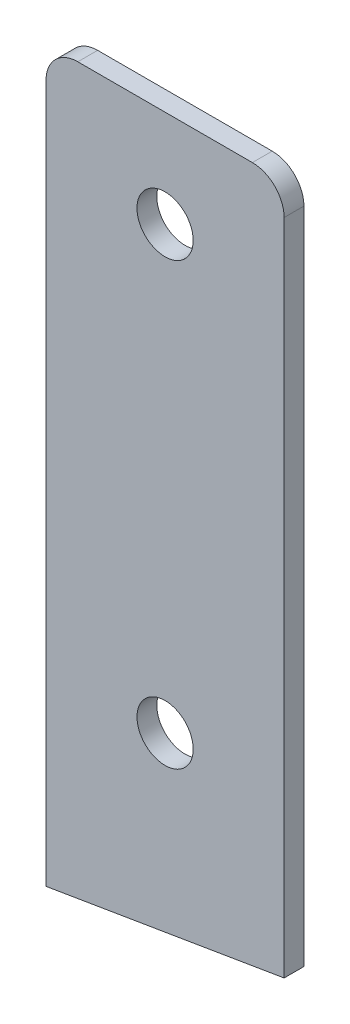
from build123d import *

# Parameters (mm, degrees)
SKETCH1_W               = 19.05
SKETCH1_H               = 50.8
BOSS_EXTRUDE1_DEPTH     = 1.5875
M4_CLEARANCE_HOLE1_D    = 4.5
SKETCH4_W               = 19.05
SKETCH4_H               = 7.62
BOSS_EXTRUDE2_DEPTH     = 1.5875
FILLET1_R               = 2.54
CUT_EXTRUDE1_DEPTH      = 35.40299669
CUT_EXTRUDE1_DEPTH_BACK = 35.40299669


with BuildPart() as part:
    # Sketch1 → Boss-Extrude1 (new body)
    with BuildSketch(Plane.XY):
        Rectangle(SKETCH1_W, SKETCH1_H)
    extrude(amount=BOSS_EXTRUDE1_DEPTH)

    # M4 Clearance Hole1 (through all)
    with Locations(Plane.XY.offset(1.5875)):
        with Locations((0, 17.6276), (0, -17.6276)):
            Hole(M4_CLEARANCE_HOLE1_D / 2)

    # Sketch4 → Boss-Extrude2 (add)
    with BuildSketch(Plane.XY.offset(1.5875)):
        with Locations((0, -29.21)):
            Rectangle(SKETCH4_W, SKETCH4_H)
    extrude(amount=-BOSS_EXTRUDE2_DEPTH)

    # Fillet1
    fillet1_edges = [part.edges().sort_by_distance(p)[0] for p in [
        (-9.525, 25.4, 0.79375),
        (9.525, 25.4, 0.79375),
    ]]
    fillet(fillet1_edges, radius=FILLET1_R)

    # Sketch5 → Cut-Extrude1 (cut, two sides: drawn at the far end of the back side and taken through both)
    with BuildSketch(Plane.XY.offset(1.5875).offset(-CUT_EXTRUDE1_DEPTH_BACK)):
        Polygon((9.525, -29.845), (-9.525, -33.02), (9.525, -33.02), align=None)
    extrude(amount=CUT_EXTRUDE1_DEPTH + CUT_EXTRUDE1_DEPTH_BACK, mode=Mode.SUBTRACT)


solid = part.part
